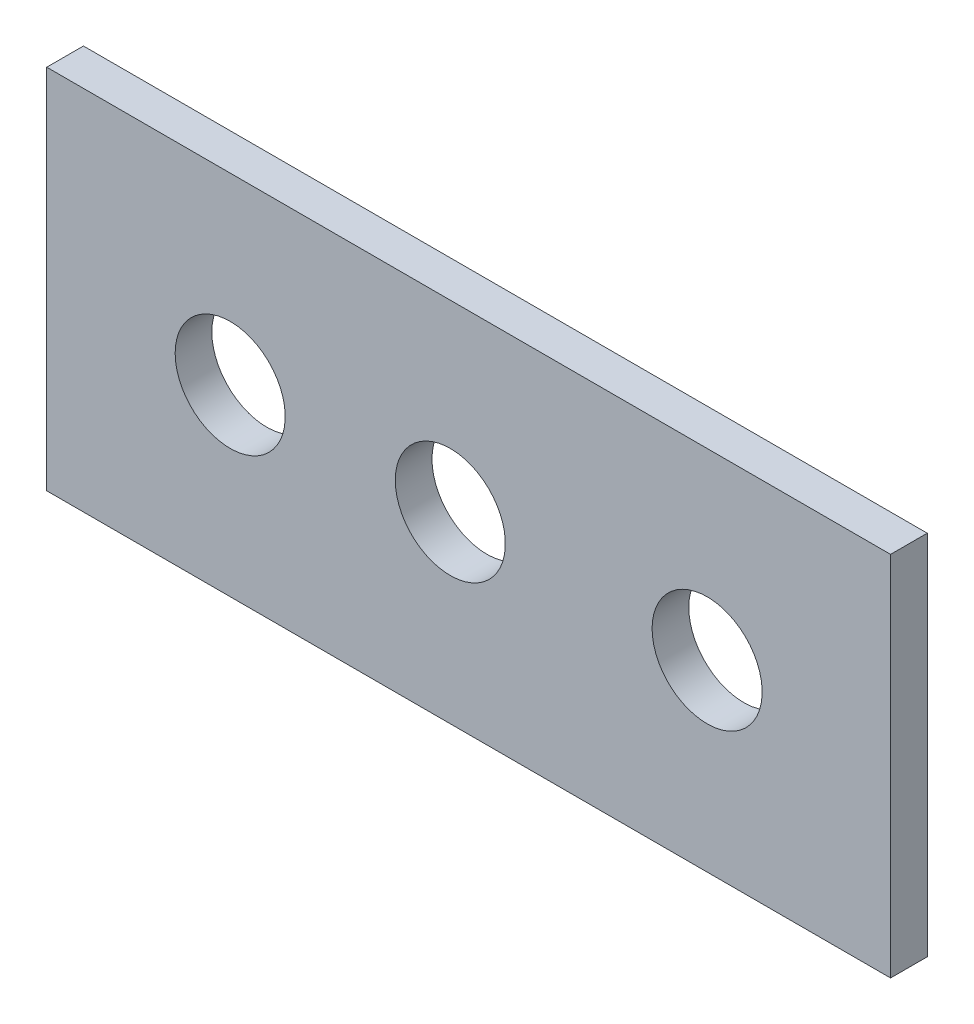
from build123d import *

# Parameters (mm, degrees)
SKETCH1_W           = 230
SKETCH1_H           = 10
BOSS_EXTRUDE1_DEPTH = 100
SKETCH2_R           = 15
CUT_EXTRUDE1_DEPTH  = 10


with BuildPart() as part:
    # Sketch1 → Boss-Extrude1 (new body)
    with BuildSketch(Plane(origin=(0, 0, 0), x_dir=(1, 0, 0), z_dir=(0, 1, 0))):
        with Locations((-115, 5)):
            Rectangle(SKETCH1_W, SKETCH1_H)
    extrude(amount=BOSS_EXTRUDE1_DEPTH)

    # Sketch2 → Cut-Extrude1 (cut)
    with BuildSketch(Plane(origin=(0, 0, -10), x_dir=(-1, 0, 0), z_dir=(0, 0, -1))):
        with Locations((50, 50)):
            Circle(SKETCH2_R)
        with Locations((180, 50)):
            Circle(SKETCH2_R)
        with Locations((120, 50)):
            Circle(SKETCH2_R)
    extrude(amount=-CUT_EXTRUDE1_DEPTH, mode=Mode.SUBTRACT)


solid = part.part
